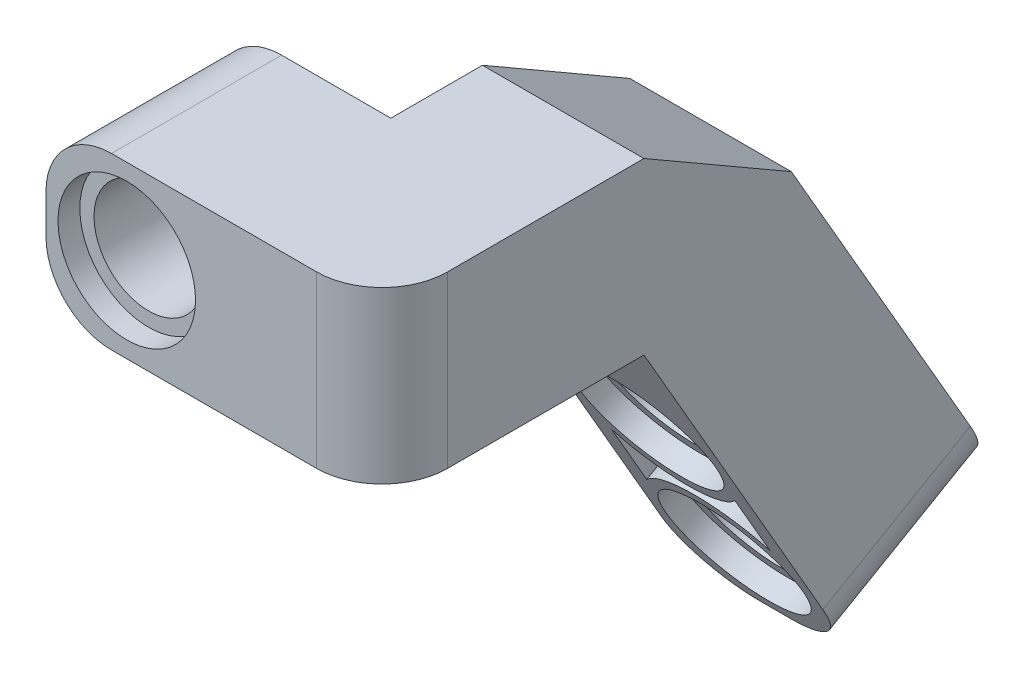
from build123d import *

# Parameters (mm, degrees)
EXTRUDE_1_DEPTH        = 7.4
EXTRUDE_2_DEPTH        = 7.8
CUT_EXTRUDE_1_REACH    = 29.801
SKETCH_4_R             = 2.499999999999999
SKETCH_4_3_R           = 3.15
SKETCH_4_3_R_2         = 2.499999999999999
CUT_EXTRUDE_2_DEPTH    = 1
CUT_EXTRUDE_START      = -6.8
SKETCH_4_4_R           = 3.15
SKETCH_4_4_R_2         = 2.499999999999999
CUT_EXTRUDE_3_DEPTH    = 1
CUT_EXTRUDE_4_DEPTH    = 1
CUT_EXTRUDE_5_DEPTH    = 1
CUT_EXTRUDE_6_REACH    = 31.056
PATTERN_LINEAR_1_COUNT = 2
PATTERN_LINEAR_1_PITCH = 8
CUT_EXTRUDE_7_DEPTH    = 2
CUT_EXTRUDE_START_2    = -5.8
CUT_EXTRUDE_8_DEPTH    = 2
FILLET_1_R             = 3
PATTERN_LINEAR_4_COUNT = 2
PATTERN_LINEAR_4_PITCH = 8


with BuildPart() as part:
    # 草图1 → 凸台-拉伸1 (new body)
    with BuildSketch(Plane(origin=(0, 0, 0), x_dir=(0, 0, -1), z_dir=(1, 0, 0))):
        Polygon((-6.94e-15, 7.800000000000002), (0, 0), (-12, 0), (-12.000000000000002, 7.8), align=None)
        Polygon((-6.94e-15, 7.800000000000002), (0, 0), (6.754998149518629, 3.8999999999999866), align=None)
        Polygon((0, 0), (9.699999999999958, -16.800892833418125), (16.45499814951859, -12.90089283341814), (6.754998149518629, 3.8999999999999866), align=None)
    extrude(amount=EXTRUDE_1_DEPTH)

    # 草图2 → 凸台-拉伸2 (add)
    with BuildSketch(Plane(origin=(0, 7.800000000000002, 1.13e-15), x_dir=(1, 0, 0), z_dir=(0, 1, 2.3e-16))):
        Polygon((0, -4.2), (-0.5999999999999981, -4.2), (-0.599999999999999, -11.999999999999998), (0, -12), align=None)
        Polygon((-0.5999999999999981, -4.2), (-0.599999999999999, -11.999999999999998), (-7.999999999999998, -12), (-8, -4.2), align=None)
    extrude(amount=-EXTRUDE_2_DEPTH)

    # 草图4 → 切除-拉伸1 (cut, up to next)
    with BuildSketch(Plane(origin=(-6.07e-15, -9.5e-16, 4.2), x_dir=(-1, 0, -1.45e-15), z_dir=(1.45e-15, 2.3e-16, -1)), mode=Mode.PRIVATE) as cut_extrude_1_sk1:
        with Locations((4.299999999999989, 3.9000000000000012)):
            Circle(SKETCH_4_R)
    cut_extrude_1_tool1 = extrude(cut_extrude_1_sk1.sketch, amount=-CUT_EXTRUDE_1_REACH, mode=Mode.PRIVATE) & part.part
    add(cut_extrude_1_tool1.solids().sort_by_distance((-4.3, 3.9, 4.2))[0], mode=Mode.SUBTRACT)

    # 草图4<3> → 切除-拉伸2 (cut)
    with BuildSketch(Plane(origin=(-6.07e-15, -9.5e-16, 4.2), x_dir=(-1, 0, -1.45e-15), z_dir=(1.45e-15, 2.3e-16, -1))):
        with Locations((4.299999999999989, 3.9000000000000012)):
            Circle(SKETCH_4_3_R)
        with Locations((4.299999999999989, 3.9000000000000012)):
            Circle(SKETCH_4_3_R_2, mode=Mode.SUBTRACT)
    extrude(amount=-CUT_EXTRUDE_2_DEPTH, mode=Mode.SUBTRACT)

    # 草图4<4> → 切除-拉伸3 (cut)
    with BuildSketch(Plane(origin=(-6.07e-15, -9.5e-16, 4.2), x_dir=(-1, 0, -1.45e-15), z_dir=(1.45e-15, 2.3e-16, -1)).offset(CUT_EXTRUDE_START)):
        with Locations((4.299999999999989, 3.9000000000000012)):
            Circle(SKETCH_4_4_R)
        with Locations((4.299999999999989, 3.9000000000000012)):
            Circle(SKETCH_4_4_R_2, mode=Mode.SUBTRACT)
    extrude(amount=-CUT_EXTRUDE_3_DEPTH, mode=Mode.SUBTRACT)

    # 草图5 → 切除-拉伸4 (cut)
    with BuildSketch(Plane(origin=(0, 3.8999999999999857, -6.754998149518631), x_dir=(1, 0, 0), z_dir=(0, 0.499999999999998, -0.8660254037844397))):
        with BuildLine():
            ThreePointArc((6.85, 15.699999999999992), (5.927386360737607, 17.927386360737636), (3.6999999999999518, 18.84999999999999))
            Line((3.7000000000000024, 18.84999999999999), (3.7000000000000024, 18.199999999999992))
            ThreePointArc((3.6999999999999913, 18.199999999999992), (5.4677669529663655, 17.467766952966365), (6.199999999999999, 15.699999999999992))
            ThreePointArc((6.199999999999999, 15.699999999999992), (5.467766952966364, 13.93223304703362), (3.699999999999989, 13.199999999999992))
            Line((3.7000000000000024, 13.199999999999992), (3.7000000000000024, 12.549999999999994))
            ThreePointArc((3.6999999999999496, 12.549999999999994), (5.927386360737607, 13.472613639262349), (6.85, 15.699999999999992))
        make_face()
        with BuildLine():
            Line((3.7000000000000024, 18.199999999999992), (3.7000000000000024, 18.84999999999999))
            ThreePointArc((3.6999999999999513, 18.84999999999999), (0.5500000000000012, 15.699999999999992), (3.6999999999999496, 12.549999999999994))
            Line((3.7000000000000024, 12.549999999999994), (3.7000000000000024, 13.199999999999992))
            ThreePointArc((3.699999999999989, 13.199999999999992), (1.2000000000000015, 15.699999999999992), (3.6999999999999913, 18.199999999999992))
        make_face()
    cut_extrude_4 = extrude(amount=-CUT_EXTRUDE_4_DEPTH, mode=Mode.SUBTRACT)

    # 草图5<3> → 切除-拉伸5 (cut)
    with BuildSketch(Plane(origin=(0, 3.8999999999999857, -6.754998149518631), x_dir=(1, 0, 0), z_dir=(0, 0.499999999999998, -0.8660254037844397)).offset(CUT_EXTRUDE_START)):
        with BuildLine():
            ThreePointArc((6.85, 15.699999999999992), (5.927386360737607, 17.927386360737636), (3.6999999999999518, 18.84999999999999))
            Line((3.7000000000000024, 18.84999999999999), (3.7000000000000024, 18.199999999999992))
            ThreePointArc((3.6999999999999913, 18.199999999999992), (5.4677669529663655, 17.467766952966365), (6.199999999999999, 15.699999999999992))
            ThreePointArc((6.199999999999999, 15.699999999999992), (5.467766952966364, 13.93223304703362), (3.699999999999989, 13.199999999999992))
            Line((3.7000000000000024, 13.199999999999992), (3.7000000000000024, 12.549999999999994))
            ThreePointArc((3.6999999999999496, 12.549999999999994), (5.927386360737607, 13.472613639262349), (6.85, 15.699999999999992))
        make_face()
        with BuildLine():
            Line((3.7000000000000024, 18.199999999999992), (3.7000000000000024, 18.84999999999999))
            ThreePointArc((3.6999999999999513, 18.84999999999999), (0.5500000000000012, 15.699999999999992), (3.6999999999999496, 12.549999999999994))
            Line((3.7000000000000024, 12.549999999999994), (3.7000000000000024, 13.199999999999992))
            ThreePointArc((3.699999999999989, 13.199999999999992), (1.2000000000000015, 15.699999999999992), (3.6999999999999913, 18.199999999999992))
        make_face()
    cut_extrude_5 = extrude(amount=-CUT_EXTRUDE_5_DEPTH, mode=Mode.SUBTRACT)

    # 草图5<4> → 切除-拉伸6 (cut, up to next)
    with BuildSketch(Plane(origin=(0, 3.8999999999999857, -6.754998149518631), x_dir=(1, 0, 0), z_dir=(0, 0.499999999999998, -0.8660254037844397)), mode=Mode.PRIVATE) as cut_extrude_6_sk1:
        with BuildLine():
            ThreePointArc((6.199999999999999, 15.699999999999992), (5.4677669529663655, 17.467766952966365), (3.6999999999999913, 18.199999999999992))
            Line((3.7000000000000024, 18.199999999999992), (3.7000000000000024, 13.199999999999992))
            ThreePointArc((3.699999999999989, 13.199999999999992), (5.467766952966364, 13.93223304703362), (6.199999999999999, 15.699999999999992))
        make_face()
    cut_extrude_6_tool1 = extrude(cut_extrude_6_sk1.sketch, amount=-CUT_EXTRUDE_6_REACH, mode=Mode.PRIVATE) & part.part
    # 草图5<4> → 切除-拉伸6 (cut, up to next)
    with BuildSketch(Plane(origin=(0, 3.8999999999999857, -6.754998149518631), x_dir=(1, 0, 0), z_dir=(0, 0.499999999999998, -0.8660254037844397)), mode=Mode.PRIVATE) as cut_extrude_6_sk2:
        with BuildLine():
            Line((3.7000000000000024, 13.199999999999992), (3.7000000000000024, 18.199999999999992))
            ThreePointArc((3.6999999999999913, 18.199999999999992), (1.2000000000000015, 15.699999999999992), (3.699999999999989, 13.199999999999992))
        make_face()
    cut_extrude_6_tool2 = extrude(cut_extrude_6_sk2.sketch, amount=-CUT_EXTRUDE_6_REACH, mode=Mode.PRIVATE) & part.part
    # 草图5<4> → 切除-拉伸6 (cut, up to next)
    with BuildSketch(Plane(origin=(0, 3.8999999999999857, -6.754998149518631), x_dir=(1, 0, 0), z_dir=(0, 0.499999999999998, -0.8660254037844397)), mode=Mode.PRIVATE) as cut_extrude_6_sk3:
        with BuildLine():
            ThreePointArc((6.199999999999999, 15.699999999999992), (5.4677669529663655, 17.467766952966365), (3.6999999999999913, 18.199999999999992))
            Line((3.7000000000000024, 18.199999999999992), (3.7000000000000024, 13.199999999999992))
            ThreePointArc((3.699999999999989, 13.199999999999992), (5.467766952966364, 13.93223304703362), (6.199999999999999, 15.699999999999992))
        make_face()
    cut_extrude_6_tool3 = extrude(cut_extrude_6_sk3.sketch, amount=-CUT_EXTRUDE_6_REACH, mode=Mode.PRIVATE) & part.part
    # 草图5<4> → 切除-拉伸6 (cut, up to next)
    with BuildSketch(Plane(origin=(0, 3.8999999999999857, -6.754998149518631), x_dir=(1, 0, 0), z_dir=(0, 0.499999999999998, -0.8660254037844397)), mode=Mode.PRIVATE) as cut_extrude_6_sk4:
        with BuildLine():
            Line((3.7000000000000024, 13.199999999999992), (3.7000000000000024, 18.199999999999992))
            ThreePointArc((3.6999999999999913, 18.199999999999992), (1.2000000000000015, 15.699999999999992), (3.699999999999989, 13.199999999999992))
        make_face()
    cut_extrude_6_tool4 = extrude(cut_extrude_6_sk4.sketch, amount=-CUT_EXTRUDE_6_REACH, mode=Mode.PRIVATE) & part.part
    cut_extrude_6_1 = cut_extrude_6_tool1.solids().sort_by_distance((4.761033, -9.696599, -14.604998))[0]
    add(cut_extrude_6_1, mode=Mode.SUBTRACT)
    cut_extrude_6_2 = cut_extrude_6_tool2.solids().sort_by_distance((2.638967, -9.696599, -14.604998))[0]
    add(cut_extrude_6_2, mode=Mode.SUBTRACT)
    cut_extrude_6_3 = cut_extrude_6_tool3.solids().sort_by_distance((4.761033, -9.696599, -14.604998))[0]
    add(cut_extrude_6_3, mode=Mode.SUBTRACT)
    cut_extrude_6_4 = cut_extrude_6_tool4.solids().sort_by_distance((2.638967, -9.696599, -14.604998))[0]
    add(cut_extrude_6_4, mode=Mode.SUBTRACT)
    cut_extrude_6 = cut_extrude_6_1 + cut_extrude_6_2 + cut_extrude_6_3 + cut_extrude_6_4  # 切除-拉伸6 as one shape, for the pattern or mirror that repeats it

    # 阵列(线性)1: 切除-拉伸4, 切除-拉伸5, 切除-拉伸6 ×2
    with Locations(*[Vector(0, 0.8660254037844397, 0.49999999999999806) * (i * PATTERN_LINEAR_1_PITCH) for i in range(1, PATTERN_LINEAR_1_COUNT)]):
        add(cut_extrude_4, mode=Mode.SUBTRACT)
        add(cut_extrude_5, mode=Mode.SUBTRACT)
        add(cut_extrude_6, mode=Mode.SUBTRACT)

    # 草图6 → 切除-拉伸7 (cut)
    with BuildSketch(Plane(origin=(0, 3.899999999999984, -6.754998149518628), x_dir=(1, 0, 0), z_dir=(0, 0.49999999999999806, -0.8660254037844398))):
        with BuildLine():
            Line((6.525000000000001, 10.089429848311095), (6.525, 13.31057015168897))
            ThreePointArc((6.52500000000005, 13.310570151688953), (3.699999999999908, 11.999999999999995), (0.8749999999998344, 13.310570151689092))
            Line((0.8750000000000009, 13.310570151689145), (0.8750000000000012, 10.089429848311095))
            ThreePointArc((0.8750000000000027, 10.089429848311095), (3.7000000000000015, 11.399999999999995), (6.525, 10.089429848311095))
        make_face()
    cut_extrude_7 = extrude(amount=-CUT_EXTRUDE_7_DEPTH, mode=Mode.SUBTRACT)

    # 草图6<3> → 切除-拉伸8 (cut)
    with BuildSketch(Plane(origin=(0, 3.899999999999984, -6.754998149518628), x_dir=(1, 0, 0), z_dir=(0, 0.49999999999999806, -0.8660254037844398)).offset(CUT_EXTRUDE_START_2)):
        with BuildLine():
            Line((6.525000000000001, 10.089429848311095), (6.525, 13.31057015168897))
            ThreePointArc((6.52500000000005, 13.310570151688953), (3.699999999999908, 11.999999999999995), (0.8749999999998344, 13.310570151689092))
            Line((0.8750000000000009, 13.310570151689145), (0.8750000000000012, 10.089429848311095))
            ThreePointArc((0.8750000000000027, 10.089429848311095), (3.7000000000000015, 11.399999999999995), (6.525, 10.089429848311095))
        make_face()
    extrude(amount=-CUT_EXTRUDE_8_DEPTH, mode=Mode.SUBTRACT)

    # 圆角1
    fillet_1_edges = [part.edges().sort_by_distance(p)[0] for p in [
        (0, -14.850892833418133, -13.077499074759274),
        (7.4, -14.850892833418133, -13.077499074759274),
        (-7.999999999999999, -5e-17, 8.1),
        (-7.999999999999999, 7.8, 8.100000000000001),
        (7.4, 3.9, 12),
    ]]
    fillet(fillet_1_edges, radius=FILLET_1_R)

    # 阵列(线性)4: 切除-拉伸7 ×2
    with Locations(*[Vector(0, 0.86602540378444, 0.4999999999999977) * (i * PATTERN_LINEAR_4_PITCH) for i in range(1, PATTERN_LINEAR_4_COUNT)]):
        add(cut_extrude_7, mode=Mode.SUBTRACT)


solid = part.part
